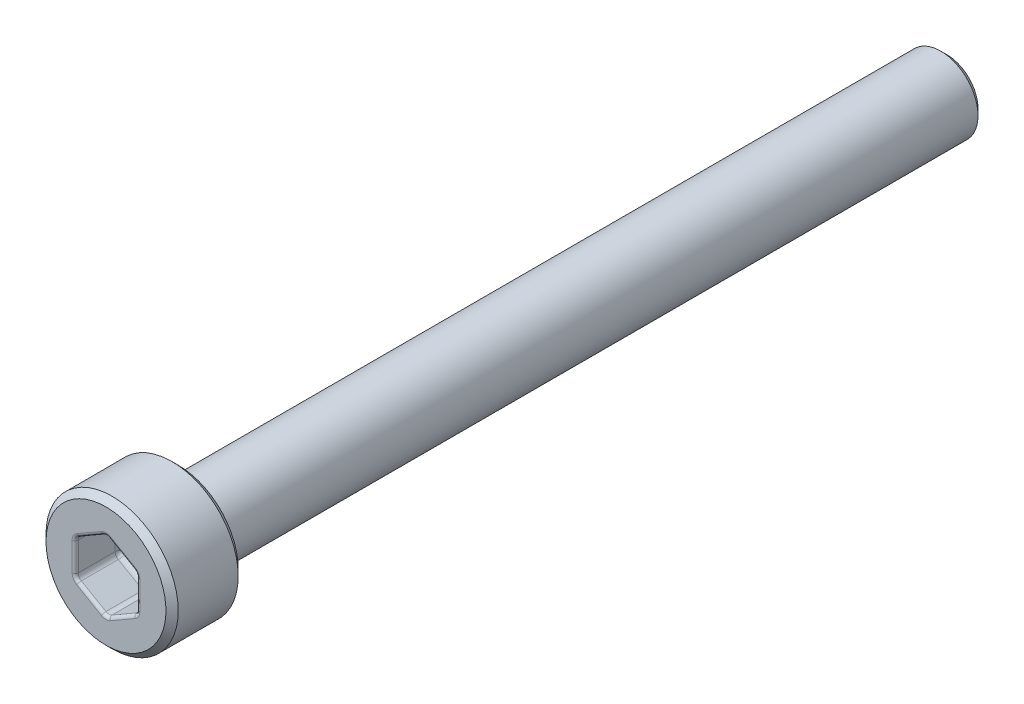
from build123d import *

# Parameters (mm, degrees)
SCHNITT_LINEAR_AUSTRAGEN1_DEPTH = 1.5
FASE1_SIZE                      = 0.2
VERRUNDUNG1_R                   = 0.2
VERRUNDUNG2_R                   = 0.1


with BuildPart() as part:
    # Skizze1 → Rotation1 (revolve)
    with BuildSketch(Plane(origin=(0, 0, 0), x_dir=(0, 0, -1), z_dir=(1, 0, 0))):
        Polygon((-2.35, 0), (-2.35, 2.15), (0, 2.15), (0, 1.21), (25, 1.21), (25, 0), align=None)
    revolve(axis=Axis((0, 0, 21.919879518), (0, 0, -1)))

    # Skizze2 → Schnitt-Linear austragen1 (cut)
    with BuildSketch(Plane.XY.offset(2.35)):
        Polygon((1, -0.577350269), (1, 0.577350269), (0, 1.154700538), (-1, 0.577350269), (-1, -0.577350269), (0, -1.154700538), align=None)
    extrude(amount=-SCHNITT_LINEAR_AUSTRAGEN1_DEPTH, mode=Mode.SUBTRACT)

    # Fase1
    fase1_edges = [part.edges().sort_by_distance(p)[0] for p in [
        (0, -2.15, 2.35),
        (0, -2.15, 0),
        (0, -1.21, -25),
    ]]
    chamfer(fase1_edges, length=FASE1_SIZE)

    # Verrundung1
    verrundung1_edges = [part.edges().sort_by_distance(p)[0] for p in [
        (-0.5, -0.866025404, 0.85),
        (-1, 0, 0.85),
        (-0.5, 0.866025404, 0.85),
        (0.5, 0.866025404, 0.85),
        (1, 0, 0.85),
        (0.5, -0.866025404, 0.85),
        (-1, -0.577350269, 1.6),
        (0, -1.154700538, 1.6),
        (1, -0.577350269, 1.6),
        (1, 0.577350269, 1.6),
        (0, 1.154700538, 1.6),
        (-1, 0.577350269, 1.6),
        (0, -1.21, 0),
    ]]
    fillet(verrundung1_edges, radius=VERRUNDUNG1_R)

    # Verrundung2
    verrundung2_edges = [part.edges().sort_by_distance(p)[0] for p in [
        (0.973205081, -0.561880215, 2.35),
        (0.5, -0.866025404, 2.35),
        (0, -1.123760431, 2.35),
        (-0.5, -0.866025404, 2.35),
        (-0.973205081, -0.561880215, 2.35),
        (-1, 0, 2.35),
        (-0.973205081, 0.561880215, 2.35),
        (-0.5, 0.866025404, 2.35),
        (0, 1.123760431, 2.35),
        (0.5, 0.866025404, 2.35),
        (0.973205081, 0.561880215, 2.35),
        (1, 0, 2.35),
    ]]
    fillet(verrundung2_edges, radius=VERRUNDUNG2_R)


solid = part.part
